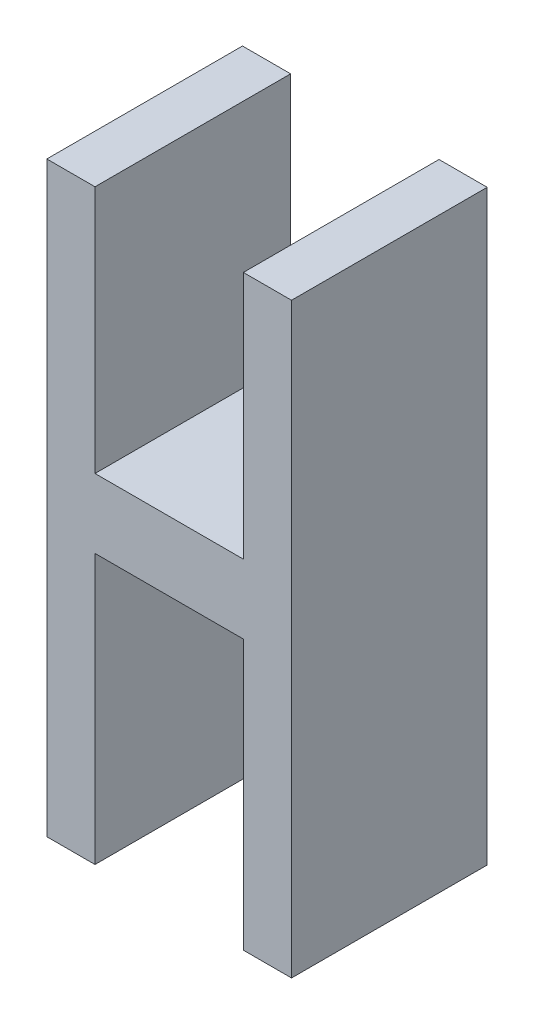
from build123d import *

# Parameters (mm, degrees)
BOSS_EXTRUDE1_DEPTH = 304.8
SHELL1_T            = -2.54
SKETCH4_W           = 50.8
SKETCH4_H           = 50.8
BOSS_EXTRUDE2_DEPTH = 381
SKETCH5_W           = 30.48
SKETCH5_H           = 279.4
CUT_EXTRUDE1_DEPTH  = 7.62
SKETCH6_W           = 63.5
SKETCH6_H           = 63.5
BOSS_EXTRUDE3_DEPTH = 2.54
SKETCH7_W           = 5.08
SKETCH7_H           = 63.5
BOSS_EXTRUDE4_DEPTH = 50.8
BOSS_EXTRUDE5_REACH = 1036.867
SKETCH8_R           = 19.05


with BuildPart() as part:
    # Sketch3 → Boss-Extrude1 (new body)
    with BuildSketch(Plane.XY):
        Polygon((427.867059624, 0), (352.824484244, 0), (352.824484244, 419.782362276), (121.685060077, 419.782362276), (121.685060077, 0), (46.642484697, 0), (46.642484697, 914.4), (121.685060077, 914.4), (121.685060077, 527.57832691), (352.824484244, 527.57832691), (352.824484244, 914.4), (427.867059624, 914.4), align=None)
    extrude(amount=-BOSS_EXTRUDE1_DEPTH)

    # Shell1
    shell1_openings = [part.faces().sort_by_distance(p)[0] for p in [
        (237.254772161, 459.732303747, -304.8),
    ]]
    offset(amount=SHELL1_T, openings=shell1_openings, kind=Kind.INTERSECTION)

    # Sketch4 → Boss-Extrude2 (add)
    with BuildSketch(Plane(origin=(0, 0, -2.54), x_dir=(-1, 0, 0), z_dir=(0, 0, -1))):
        with Locations((-237.254772161, 473.630362276)):
            Rectangle(SKETCH4_W, SKETCH4_H)
    extrude(amount=BOSS_EXTRUDE2_DEPTH)

    # Sketch5 → Cut-Extrude1 (cut)
    with BuildSketch(Plane.XZ.offset(-419.782362276)):
        with Locations((239.682484697, -165.1)):
            Rectangle(SKETCH5_W, SKETCH5_H)
    extrude(amount=-CUT_EXTRUDE1_DEPTH, mode=Mode.SUBTRACT)

    # Sketch6 → Boss-Extrude3 (add)
    with BuildSketch(Plane(origin=(0, 0, -383.54), x_dir=(-1, 0, 0), z_dir=(0, 0, -1))):
        with Locations((-237.254772161, 473.630362276)):
            Rectangle(SKETCH6_W, SKETCH6_H)
    extrude(amount=BOSS_EXTRUDE3_DEPTH)

    # Sketch7 → Boss-Extrude4 (add)
    with BuildSketch(Plane(origin=(0, 0, -386.08), x_dir=(-1, 0, 0), z_dir=(0, 0, -1))):
        with Locations((-258.844772161, 473.630362276)):
            Rectangle(SKETCH7_W, SKETCH7_H)
        with Locations((-215.664772161, 473.630362276)):
            Rectangle(SKETCH7_W, SKETCH7_H)
    extrude(amount=BOSS_EXTRUDE4_DEPTH)

    # Sketch8 → Boss-Extrude5 (add, up to next)
    with BuildSketch(Plane.ZY.offset(-256.304772161), mode=Mode.PRIVATE) as boss_extrude5_sk1:
        with Locations(Location((-411.48, 473.630362276, 0), (0, 0, 180))):
            Circle(SKETCH8_R)
    boss_extrude5_tool1 = extrude(boss_extrude5_sk1.sketch, amount=BOSS_EXTRUDE5_REACH, mode=Mode.PRIVATE) - part.part
    add(boss_extrude5_tool1.solids().sort_by_distance((256.304772, 473.630362, -411.48))[0])


solid = part.part
